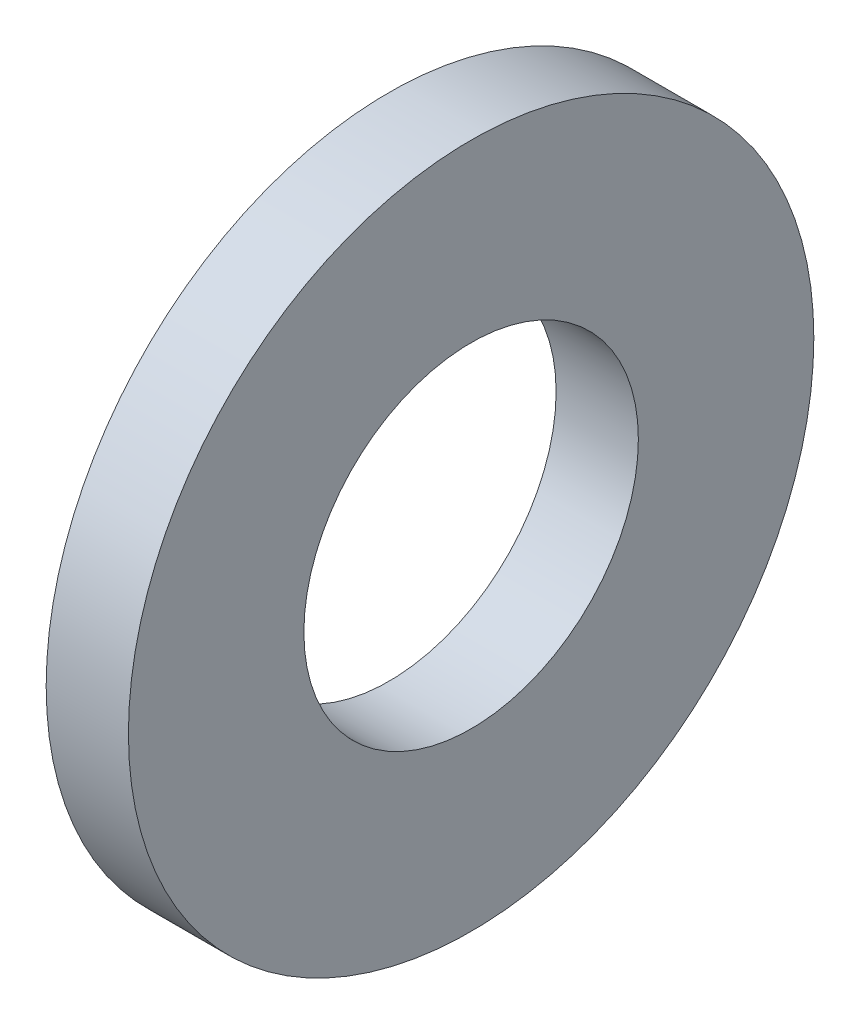
from build123d import *

# Parameters (mm, degrees)
SKETCH1_W = 1.2
SKETCH1_H = 2.56


with BuildPart() as part:
    # Sketch1 → Base-Revolve (revolve)
    with BuildSketch(Plane.XY, mode=Mode.PRIVATE) as base_revolve_sk:
        with Locations((-0.6, 3.72)):
            Rectangle(SKETCH1_W, SKETCH1_H)
    revolve(base_revolve_sk.sketch.rotate(Axis((-34.925, 0, 0), (1, 0, 0)), 90), axis=Axis((-34.925, 0, 0), (1, 0, 0)))


solid = part.part
